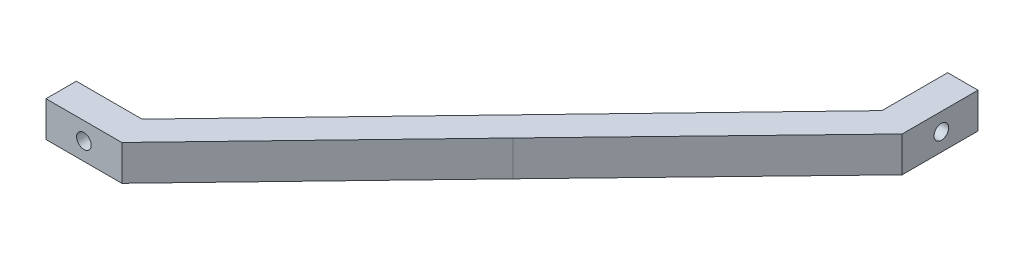
from build123d import *

# Parameters (mm, degrees)
BOSS_EXTRUDE1_DEPTH = 7
SKETCH14_R          = 1.45
CUT_EXTRUDE1_DEPTH  = 10
SKETCH15_R          = 1.45
CUT_EXTRUDE2_DEPTH  = 10


with BuildPart() as part:
    # Sketch12 → Boss-Extrude1 (new body)
    with BuildSketch(Plane(origin=(0, 0, 0), x_dir=(1, 0, 0), z_dir=(0, 1, 0))):
        Polygon((85.522563955, 6.5), (85.522563955, -8.5), (47.695057641, -47.704563591), (9.792563955, -87.15), (-5.207436045, -87.15), (-5.207436045, -81.15), (7.792563955, -81.15), (43.657563955, -43.825), (79.522563955, -6.5), (79.522563955, 6.5), align=None)
    extrude(amount=BOSS_EXTRUDE1_DEPTH)

    # Sketch14 → Cut-Extrude1 (cut)
    with BuildSketch(Plane(origin=(0, 0, 81.15), x_dir=(-1, 0, 0), z_dir=(0, 0, -1))):
        with Locations((-2.292563955, 3.5)):
            Circle(SKETCH14_R)
    extrude(amount=-CUT_EXTRUDE1_DEPTH, mode=Mode.SUBTRACT)

    # Sketch15 → Cut-Extrude2 (cut)
    with BuildSketch(Plane.ZY.offset(-79.522563955)):
        with Locations((0.75, 3.5)):
            Circle(SKETCH15_R)
    extrude(amount=-CUT_EXTRUDE2_DEPTH, mode=Mode.SUBTRACT)


solid = part.part
